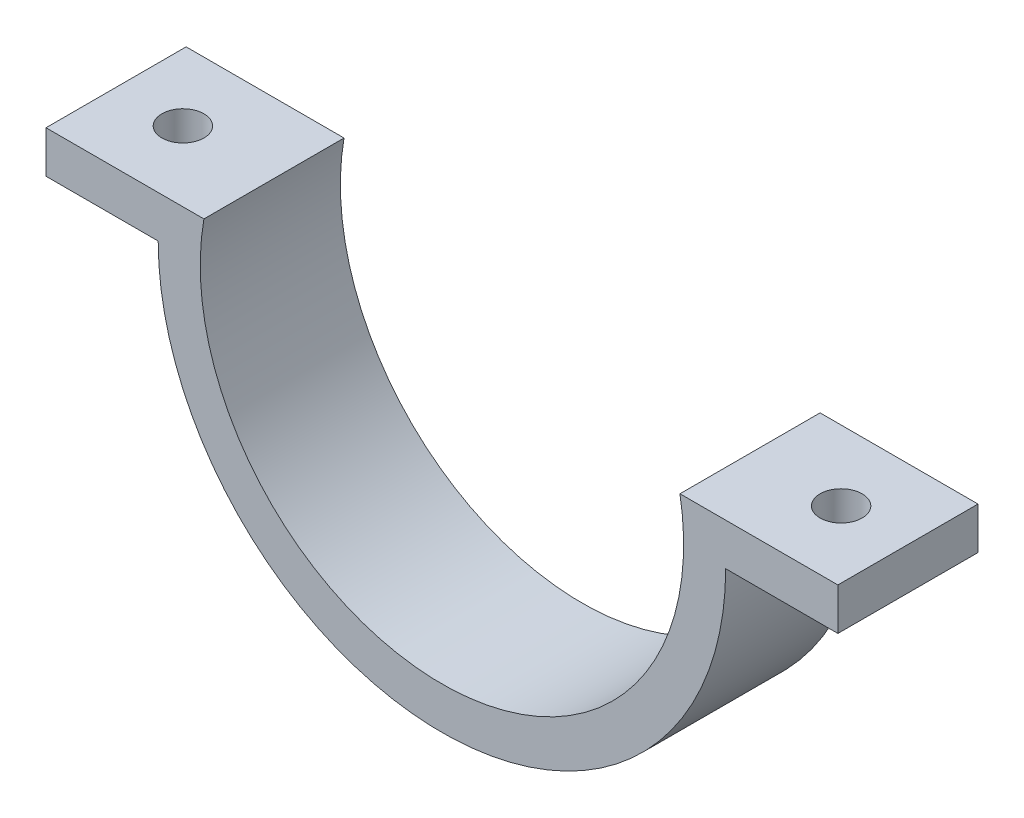
from build123d import *

# Parameters (mm, degrees)
SKETCH1_W           = 1.27
SKETCH1_H           = 3
BOSS_EXTRUDE1_DEPTH = 10
CUT_EXTRUDE1_DEPTH  = 3


with BuildPart() as part:
    # Sketch1 → Boss-Extrude1 (new body)
    with BuildSketch(Plane.XY):
        with BuildLine():
            ThreePointArc((17.250000044, 0), (-1.505747486, -17.18415625), (-16.987127524, 3))
            Line((-16.987127524, 3), (-26.987127524, 3))
            Line((-26.987127524, 3), (-26.987127524, 0))
            Line((-26.987127524, 0), (-20.250000044, 0))
            ThreePointArc((-20.250000044, 0), (0, -20.250000044), (20.250000044, 0))
            Line((20.250000044, 0), (26.987127524, 0))
            Line((26.987127524, 0), (26.987127524, 3))
            Line((26.987127524, 3), (16.987127524, 3))
            ThreePointArc((16.987127524, 3), (17.18415625, 1.505747486), (17.250000044, 0))
        make_face()
        with Locations((27.622127524, 1.5)):
            Rectangle(SKETCH1_W, SKETCH1_H)
        with Locations((-27.622127524, 1.5)):
            Rectangle(SKETCH1_W, SKETCH1_H)
    extrude(amount=BOSS_EXTRUDE1_DEPTH)

    # Sketch2 → Cut-Extrude1 (cut)
    with BuildSketch(Plane(origin=(0, 3, 0), x_dir=(1, 0, 0), z_dir=(0, 1, 0))):
        with BuildLine():
            ThreePointArc((-21.987127524, -5), (-23.487127524, -3.5), (-24.987127524, -5))
            Line((-24.987127524, -5), (-21.987127524, -5))
        make_face()
        with BuildLine():
            Line((-21.987127524, -5), (-24.987127524, -5))
            ThreePointArc((-24.987127524, -5), (-23.487127524, -6.5), (-21.987127524, -5))
        make_face()
    cut_extrude1 = extrude(amount=-CUT_EXTRUDE1_DEPTH, mode=Mode.SUBTRACT)

    # Mirror1: Cut-Extrude1 across plane
    add(cut_extrude1.mirror(Plane(origin=(0, 0, 0), x_dir=(0, 0, 1), z_dir=(1, 0, 0))), mode=Mode.SUBTRACT)


solid = part.part
